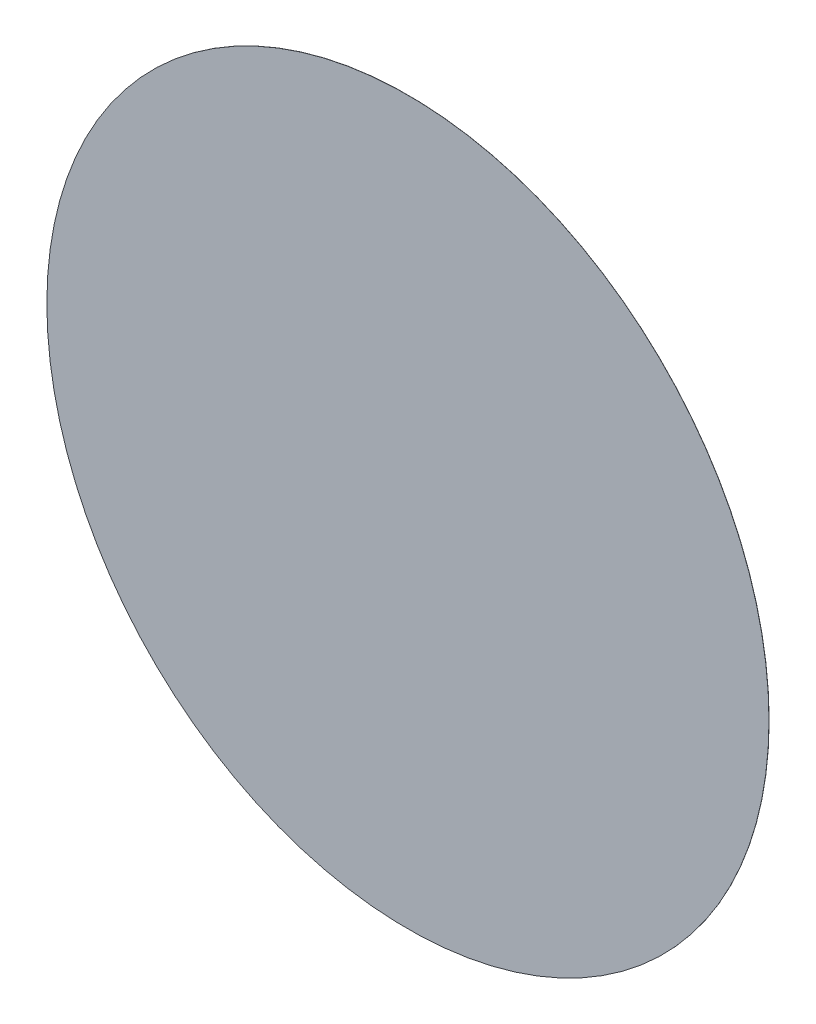
from build123d import *

# Parameters (mm, degrees)
SKETCH_1_R      = 250.15877109
EXTRUDE_1_DEPTH = 0.1


with BuildPart() as part:
    # 草图1 → 凸台-拉伸1 (new body)
    with BuildSketch(Plane.XY):
        with Locations((-0.097852653, 0.103560511)):
            Circle(SKETCH_1_R)
    extrude(amount=EXTRUDE_1_DEPTH)


solid = part.part
